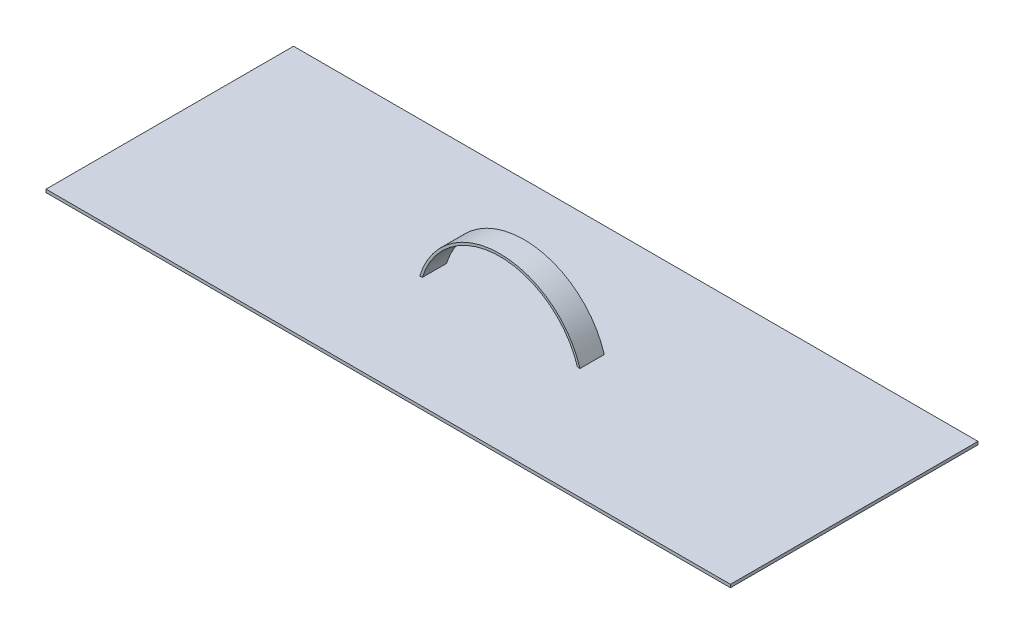
from build123d import *

# Parameters (mm, degrees)
SKETCH1_W           = 262
SKETCH1_H           = 82
BOSS_EXTRUDE1_DEPTH = 10
SKETCH2_W           = 282
SKETCH2_H           = 102
BOSS_EXTRUDE2_DEPTH = 1.25
SKETCH3_R           = 34.5
SKETCH3_R_2         = 33.5
BOSS_EXTRUDE3_DEPTH = 5


with BuildPart() as part:
    # Sketch1 → Boss-Extrude1 (new body)
    with BuildSketch(Plane(origin=(0, 2.5, 0), x_dir=(1, 0, 0), z_dir=(0, 1, 0))):
        with Locations((120, -30)):
            Rectangle(SKETCH1_W, SKETCH1_H)
    extrude(amount=BOSS_EXTRUDE1_DEPTH)

    # Sketch2 → Boss-Extrude2 (add)
    with BuildSketch(Plane(origin=(0, 12.5, 0), x_dir=(1, 0, 0), z_dir=(0, 1, 0))):
        with Locations((120, -30)):
            Rectangle(SKETCH2_W, SKETCH2_H)
    extrude(amount=BOSS_EXTRUDE2_DEPTH)

    # Sketch3 → Boss-Extrude3 (add, symmetric)
    with BuildSketch(Plane.XY.offset(30)):
        with Locations((120, 3.75)):
            Circle(SKETCH3_R)
        with Locations((120, 3.75)):
            Circle(SKETCH3_R_2, mode=Mode.SUBTRACT)
    extrude(amount=BOSS_EXTRUDE3_DEPTH, both=True)


solid = part.part
